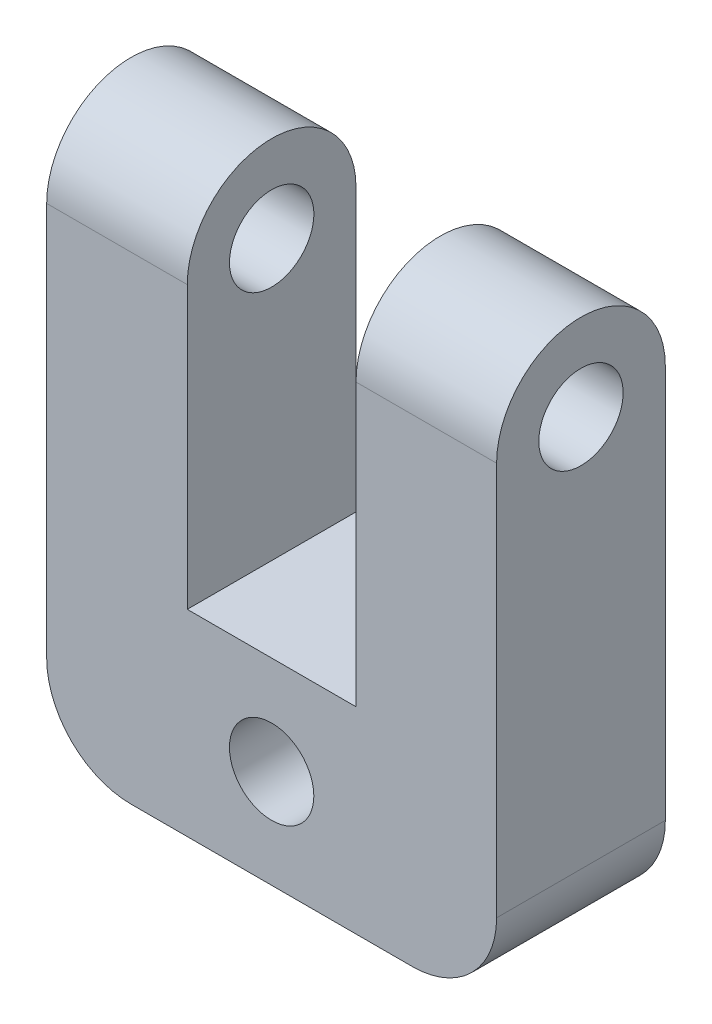
from build123d import *

# Parameters (mm, degrees)
SKETCH_1_W          = 16
SKETCH_1_H          = 6
EXTRUDE_1_DEPTH     = 7
SKETCH_3_R          = 1.5
EXTRUDE_2_DEPTH     = 8
SKETCH_3_2_R        = 1.5
CUT_EXTRUDE_2_DEPTH = 3
SKETCH_9_R          = 1.5
CUT_EXTRUDE_3_DEPTH = 10
FILLET_4_R          = 3
FILLET_5_R          = 3


with BuildPart() as part:
    # 草图1 → 凸台-拉伸1 (new body)
    with BuildSketch(Plane(origin=(0, 0, 0), x_dir=(1, 0, 0), z_dir=(0, 1, 0))):
        Rectangle(SKETCH_1_W, SKETCH_1_H)
    extrude(amount=EXTRUDE_1_DEPTH)

    # 草图3 → 凸台-拉伸2 (add, symmetric)
    with BuildSketch(Plane.ZY):
        with BuildLine():
            Line((3, 7), (-3, 7))
            Line((-3, 7), (-3, 17))
            ThreePointArc((-3, 17), (0, 20), (3, 17))
            Line((3, 17), (3, 7))
        make_face()
        with Locations((-0.000581651, 16.923736161)):
            Circle(SKETCH_3_R, mode=Mode.SUBTRACT)
    extrude(amount=EXTRUDE_2_DEPTH, both=True)

    # 草图3<2> → 切除-拉伸2 (cut, symmetric)
    with BuildSketch(Plane.ZY):
        with BuildLine():
            Line((3, 7), (-3, 7))
            Line((-3, 7), (-3, 17))
            ThreePointArc((-3, 17), (0, 20), (3, 17))
            Line((3, 17), (3, 7))
        make_face()
        with Locations((-0.000581651, 16.923736161)):
            Circle(SKETCH_3_2_R, mode=Mode.SUBTRACT)
    extrude(amount=CUT_EXTRUDE_2_DEPTH, both=True, mode=Mode.SUBTRACT)

    # 草图9 → 切除-拉伸3 (cut)
    with BuildSketch(Plane.XY.offset(5)):
        with Locations((0, 3.5)):
            Circle(SKETCH_9_R)
    extrude(amount=-CUT_EXTRUDE_3_DEPTH, mode=Mode.SUBTRACT)

    # 圆角4
    fillet_4_edges = [part.edges().sort_by_distance(p)[0] for p in [
        (8, 0, 0),
    ]]
    fillet(fillet_4_edges, radius=FILLET_4_R)

    # 圆角5
    fillet_5_edges = [part.edges().sort_by_distance(p)[0] for p in [
        (-8, 0, 0),
    ]]
    fillet(fillet_5_edges, radius=FILLET_5_R)


solid = part.part
